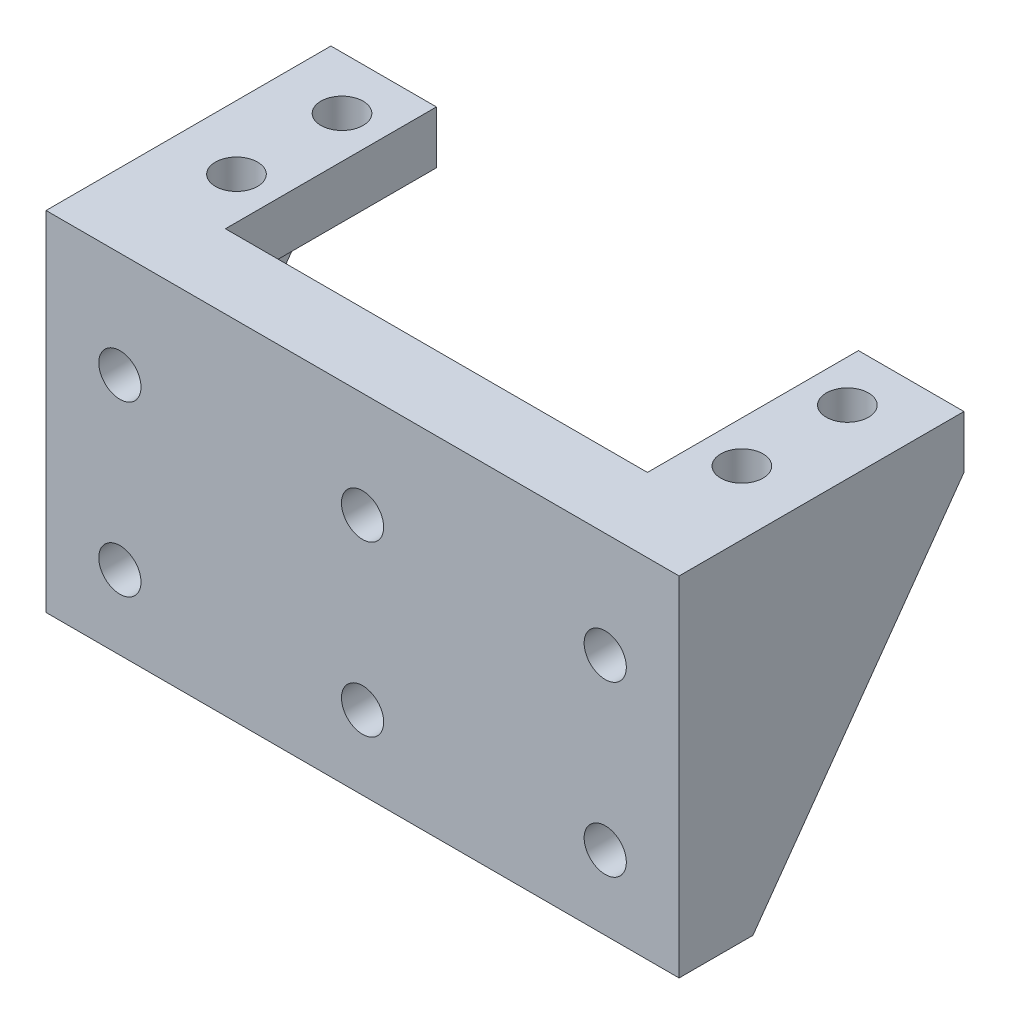
from build123d import *

# Parameters (mm, degrees)
SKETCH2_W               = 8
SKETCH2_H               = 20
SKETCH2_W_2             = 11.75
SKETCH2_H_2             = 12.66
BOSS_EXTRUDE1_DEPTH     = 5
SKETCH3_W               = 13.1
SKETCH3_H               = 7
BOSS_EXTRUDE2_DEPTH     = 28
SKETCH4_W               = 5.75
SKETCH4_H               = 12.66
CUT_EXTRUDE1_DEPTH      = 62.587336361
SKETCH5_R               = 2
CUT_EXTRUDE2_DEPTH      = 61.902073035
SKETCH6_R               = 2
CUT_EXTRUDE3_DEPTH      = 60.059292241
SKETCH7_W               = 7
SKETCH7_H               = 28
BOSS_EXTRUDE3_DEPTH     = 19.4
SKETCH8_W               = 27
SKETCH8_H               = 33
BOSS_EXTRUDE4_DEPTH     = 2
SKETCH9_W               = 27
SKETCH9_H               = 33
BOSS_EXTRUDE5_DEPTH     = 2
CUT_EXTRUDE4_DEPTH      = 68.4388612
CUT_EXTRUDE4_DEPTH_BACK = 68.4388612
SKETCH11_W              = 12.66
SKETCH11_H              = 33
CUT_EXTRUDE5_DEPTH      = 48.572287101
SKETCH12_R              = 2
CUT_EXTRUDE6_DEPTH      = 61.695963622
SKETCH13_R              = 4
SKETCH13_R_2            = 2
CUT_EXTRUDE7_DEPTH      = 2.8


with BuildPart() as part:
    # Sketch2 → Boss-Extrude1 (new body)
    with BuildSketch(Plane(origin=(0, 0, 0), x_dir=(1, 0, 0), z_dir=(0, 1, 0))):
        with Locations((-4, 10)):
            Rectangle(SKETCH2_W, SKETCH2_H)
        Polygon((40, 0), (0, 0), (-8, 0), (-8, -7), (3.75, -7), (16.85, -7), (28.6, -7), (48, -7), (48, 0), align=None)
        with Locations((-2.125, -13.33)):
            Rectangle(SKETCH2_W_2, SKETCH2_H_2)
        with Locations((22.725, -13.33)):
            Rectangle(SKETCH2_W_2, SKETCH2_H_2)
        with Locations((44, 10)):
            Rectangle(SKETCH2_W, SKETCH2_H)
    extrude(amount=BOSS_EXTRUDE1_DEPTH)

    # Sketch3 → Boss-Extrude2 (add)
    with BuildSketch(Plane.XZ):
        Polygon((3.75, 19.66), (-8, 19.66), (-8, 0), (0, 0), (3.75, 0), (3.75, 7), align=None)
        with Locations((10.3, 3.5)):
            Rectangle(SKETCH3_W, SKETCH3_H)
        Polygon((16.85, 19.66), (16.85, 7), (16.85, 0), (28.6, 0), (28.6, 7), (28.6, 19.66), align=None)
    extrude(amount=BOSS_EXTRUDE2_DEPTH)

    # Sketch4 → Cut-Extrude1 (cut, through all)
    with BuildSketch(Plane.XZ.offset(28)):
        with Locations((-5.125, 13.33)):
            Rectangle(SKETCH4_W, SKETCH4_H)
        with Locations((25.725, 13.33)):
            Rectangle(SKETCH4_W, SKETCH4_H)
    extrude(amount=-CUT_EXTRUDE1_DEPTH, mode=Mode.SUBTRACT)

    # Sketch5 → Cut-Extrude2 (cut, through all)
    with BuildSketch(Plane.ZY.offset(2.25)):
        with Locations((13.33, -2)):
            Circle(SKETCH5_R)
        with Locations((13.33, -21)):
            Circle(SKETCH5_R)
        with Locations((13.33, -11.5)):
            Circle(SKETCH5_R)
    extrude(amount=-CUT_EXTRUDE2_DEPTH, mode=Mode.SUBTRACT)

    # Sketch6 → Cut-Extrude3 (cut, through all)
    with BuildSketch(Plane.XZ):
        with Locations(Location((43.95, -5, 0), (0, 0, 270))):
            Circle(SKETCH6_R)
        with Locations(Location((43.95, -15, 0), (0, 0, 270))):
            Circle(SKETCH6_R)
        with Locations(Location((-3.95, -5, 0), (0, 0, 270))):
            Circle(SKETCH6_R)
        with Locations(Location((-3.95, -15, 0), (0, 0, 270))):
            Circle(SKETCH6_R)
    extrude(amount=-CUT_EXTRUDE3_DEPTH, mode=Mode.SUBTRACT)

    # Sketch7 → Boss-Extrude3 (add)
    with BuildSketch(Plane(origin=(28.6, 0, 0), x_dir=(0, 0, -1), z_dir=(1, 0, 0))):
        with Locations((-3.5, -14)):
            Rectangle(SKETCH7_W, SKETCH7_H)
    extrude(amount=BOSS_EXTRUDE3_DEPTH)

    # Sketch8 → Boss-Extrude4 (add)
    with BuildSketch(Plane(origin=(48, 0, 0), x_dir=(0, 0, -1), z_dir=(1, 0, 0))):
        with Locations((6.5, -11.5)):
            Rectangle(SKETCH8_W, SKETCH8_H)
    extrude(amount=BOSS_EXTRUDE4_DEPTH)

    # Sketch9 → Boss-Extrude5 (add)
    with BuildSketch(Plane.ZY.offset(8)):
        with Locations((-6.5, -11.5)):
            Rectangle(SKETCH9_W, SKETCH9_H)
    extrude(amount=BOSS_EXTRUDE5_DEPTH)

    # Sketch10 → Cut-Extrude4 (cut, two sides: drawn at the far end of the back side and taken through both)
    with BuildSketch(Plane.ZY.offset(-48).offset(-CUT_EXTRUDE4_DEPTH_BACK)):
        Polygon((-20, 0), (0, -28), (-20, -28), align=None)
    extrude(amount=CUT_EXTRUDE4_DEPTH + CUT_EXTRUDE4_DEPTH_BACK, mode=Mode.SUBTRACT)

    # Sketch11 → Cut-Extrude5 (cut, through all)
    with BuildSketch(Plane(origin=(22.85, 0, 0), x_dir=(0, 0, -1), z_dir=(1, 0, 0))):
        with Locations((-13.33, -11.5)):
            Rectangle(SKETCH11_W, SKETCH11_H)
    extrude(amount=-CUT_EXTRUDE5_DEPTH, mode=Mode.SUBTRACT)

    # Sketch12 → Cut-Extrude6 (cut, through all)
    with BuildSketch(Plane(origin=(0, 0, 0), x_dir=(-1, 0, 0), z_dir=(0, 0, -1))):
        with Locations((-43, -5)):
            Circle(SKETCH12_R)
        with Locations((3, -5)):
            Circle(SKETCH12_R)
        with Locations((3, -21)):
            Circle(SKETCH12_R)
        with Locations((-43, -21)):
            Circle(SKETCH12_R)
        with Locations((-20, -5)):
            Circle(SKETCH12_R)
        with Locations((-20, -21)):
            Circle(SKETCH12_R)
    extrude(amount=-CUT_EXTRUDE6_DEPTH, mode=Mode.SUBTRACT)

    # Sketch13 → Cut-Extrude7 (cut)
    # profile 1 of 6: a face of its own
    with BuildSketch(Plane(origin=(0, 0, 0), x_dir=(-1, 0, 0), z_dir=(0, 0, -1))):
        with Locations((3, -5)):
            Circle(SKETCH13_R)
        with Locations((3, -5)):
            Circle(SKETCH13_R_2, mode=Mode.SUBTRACT)
    # profile 2 of 6: a face of its own
    with BuildSketch(Plane(origin=(0, 0, 0), x_dir=(-1, 0, 0), z_dir=(0, 0, -1))):
        with Locations((-43, -5)):
            Circle(SKETCH13_R)
        with Locations((-43, -5)):
            Circle(SKETCH13_R_2, mode=Mode.SUBTRACT)
    # profile 3 of 6: a face of its own
    with BuildSketch(Plane(origin=(0, 0, 0), x_dir=(-1, 0, 0), z_dir=(0, 0, -1))):
        with Locations((3, -21)):
            Circle(SKETCH13_R)
    # profile 4 of 6: a face of its own
    with BuildSketch(Plane(origin=(0, 0, 0), x_dir=(-1, 0, 0), z_dir=(0, 0, -1))):
        with Locations((-43, -21)):
            Circle(SKETCH13_R)
    # profile 5 of 6: a face of its own
    with BuildSketch(Plane(origin=(0, 0, 0), x_dir=(-1, 0, 0), z_dir=(0, 0, -1))):
        with Locations((-20, -21)):
            Circle(SKETCH13_R)
    # profile 6 of 6: a face of its own
    with BuildSketch(Plane(origin=(0, 0, 0), x_dir=(-1, 0, 0), z_dir=(0, 0, -1))):
        with Locations((-20, -5)):
            Circle(SKETCH13_R)
    extrude(amount=-CUT_EXTRUDE7_DEPTH, mode=Mode.SUBTRACT)


solid = part.part
